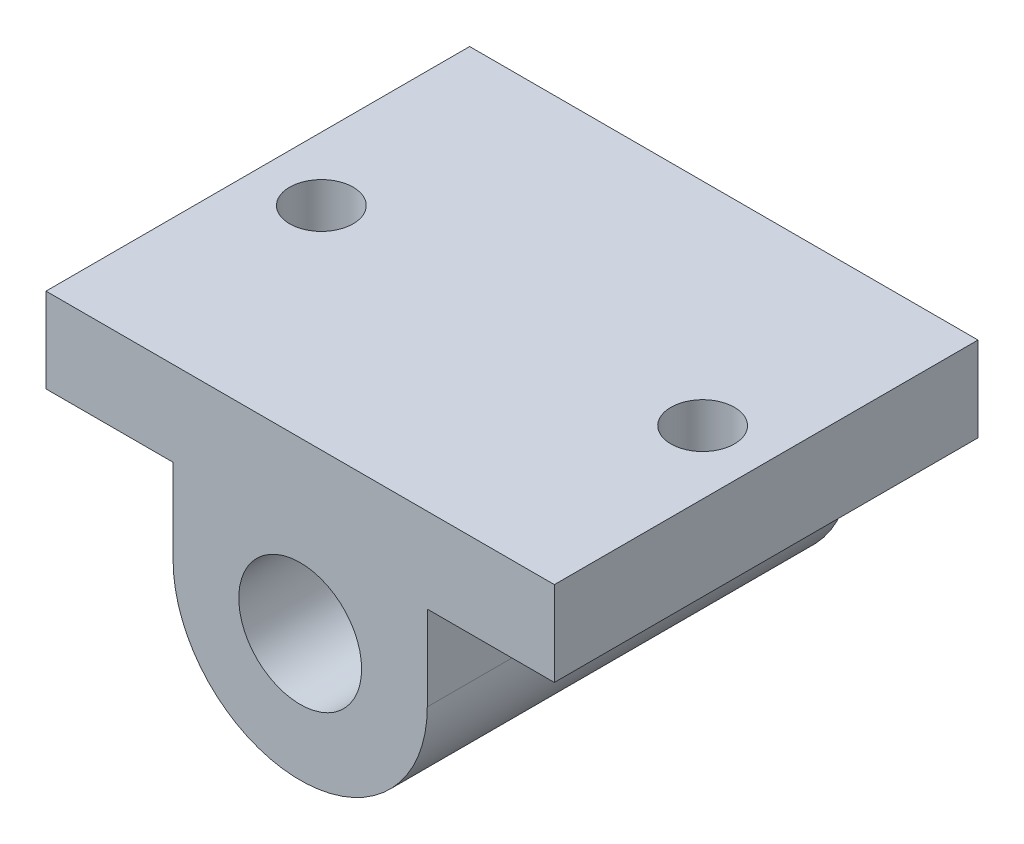
from build123d import *

# Parameters (mm, degrees)
ESQUISSE1_R             = 4
BOSS_EXTRU_1_DEPTH      = 20
ESQUISSE2_R             = 4
ESQUISSE2_R_2           = 2.9
BOSS_EXTRU_2_DEPTH      = 17.5
ESQUISSE3_R             = 1.5
ENL_V_MAT_EXTRU_1_DEPTH = 17.5


with BuildPart() as part:
    # Esquisse1 → Boss.-Extru.1 (new body)
    with BuildSketch(Plane.XY):
        with BuildLine():
            Line((-12, 4), (-6, 4))
            Line((-6, 4), (-6, 0))
            ThreePointArc((-6, 0), (0, -6), (6, 0))
            Line((6, 0), (6, 4))
            Line((6, 4), (12, 4))
            Line((12, 4), (12, 8))
            Line((12, 8), (-12, 8))
            Line((-12, 8), (-12, 4))
        make_face()
        Circle(ESQUISSE1_R, mode=Mode.SUBTRACT)
    extrude(amount=-BOSS_EXTRU_1_DEPTH)

    # Esquisse2 → Boss.-Extru.2 (add)
    with BuildSketch(Plane.XY):
        Circle(ESQUISSE2_R)
        Circle(ESQUISSE2_R_2, mode=Mode.SUBTRACT)
    extrude(amount=-BOSS_EXTRU_2_DEPTH)

    # Esquisse3 → Enlèv. mat.-Extru.1 (cut)
    with BuildSketch(Plane.XZ.offset(-4)):
        with Locations(Location((9, -10, 0), (0, 0, 270))):
            Circle(ESQUISSE3_R)
        with Locations(Location((-9, -10, 0), (0, 0, 270))):
            Circle(ESQUISSE3_R)
    extrude(amount=-ENL_V_MAT_EXTRU_1_DEPTH, mode=Mode.SUBTRACT)


solid = part.part
